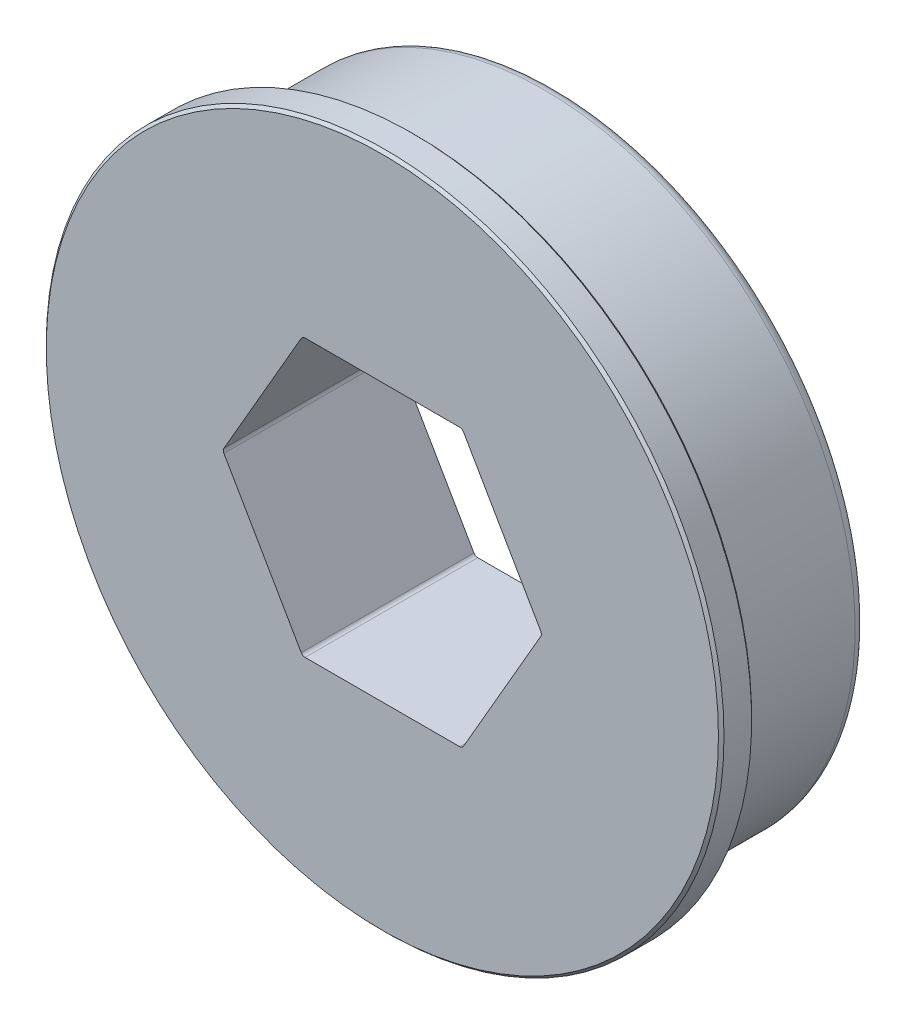
from build123d import *

# Parameters (mm, degrees)
CUT_EXTRUDE1_DEPTH = 24.386199605
CHAMFER1_SIZE      = 0.127
FILLET1_R          = 0.2032
FILLET2_R          = 0.508


with BuildPart() as part:
    # Sketch1 → Revolve1 (revolve)
    with BuildSketch(Plane.XZ, mode=Mode.PRIVATE) as revolve1_sk:
        Polygon((15.5575, 7.92734), (0, 7.92734), (0, 0), (14.2875, 0), (14.2875, 5.89534), (13.97, 5.89534), (13.97, 6.40334), (15.5575, 6.40334), align=None)
    revolve(revolve1_sk.sketch.rotate(Axis((0, 0, 7.92734), (0, 0, -1)), 180), axis=Axis((0, 0, 7.92734), (0, 0, -1)))

    # Sketch2 → Cut-Extrude1 (cut, through all)
    with BuildSketch(Plane(origin=(0, 0, 0), x_dir=(-1, 0, 0), z_dir=(0, 0, -1))):
        Polygon((3.666174209, 6.35), (-3.666174209, 6.35), (-7.332348419, 0), (-3.666174209, -6.35), (3.666174209, -6.35), (7.332348419, 0), align=None)
    extrude(amount=-CUT_EXTRUDE1_DEPTH, mode=Mode.SUBTRACT)

    # Chamfer1
    chamfer1_edges = [part.edges().sort_by_distance(p)[0] for p in [
        (15.5575, 0, 7.92734),
        (15.5575, 0, 6.40334),
    ]]
    chamfer(chamfer1_edges, length=CHAMFER1_SIZE)

    # Fillet1
    fillet1_edges = [part.edges().sort_by_distance(p)[0] for p in [
        (-3.666174209, 6.35, 3.96367),
        (-7.332348419, 0, 3.96367),
        (-3.666174209, -6.35, 3.96367),
        (3.666174209, -6.35, 3.96367),
        (7.332348419, 0, 3.96367),
        (3.666174209, 6.35, 3.96367),
    ]]
    fillet(fillet1_edges, radius=FILLET1_R)

    # Fillet2
    fillet2_edges = [part.edges().sort_by_distance(p)[0] for p in [
        (14.2875, 0, 0),
    ]]
    fillet(fillet2_edges, radius=FILLET2_R)


solid = part.part
